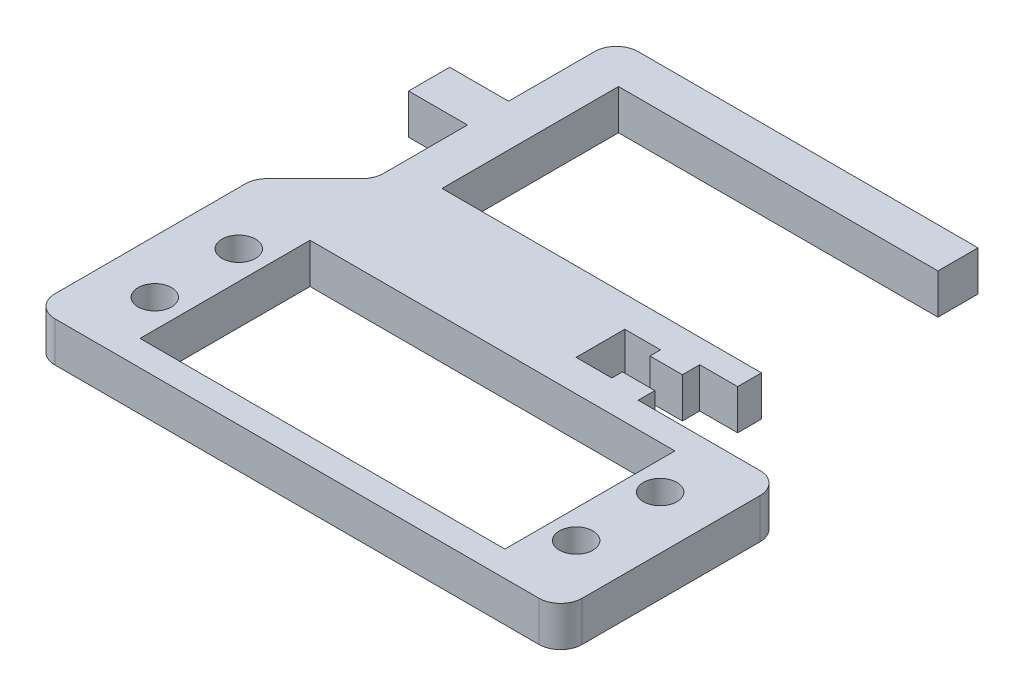
from build123d import *

# Parameters (mm, degrees)
SKETCH1_W               = 42.799
SKETCH1_H               = 19.939
BOSS_EXTRUDE1_DEPTH     = 4.699
FILLET1_R               = 2.54
CUT_EXTRUDE2_DEPTH      = 58.606234053
CUT_EXTRUDE2_DEPTH_BACK = 58.606234053
SKETCH1_3_R             = 1.9685


with BuildPart() as part:
    # Sketch1 → Boss-Extrude1 (new body)
    with BuildSketch(Plane(origin=(0, 0, 0), x_dir=(1, 0, 0), z_dir=(0, 1, 0))):
        Polygon((-23.876, 20.0152), (-30.9245, 12.9667), (-30.9245, -12.9667), (30.9245, -12.9667), (30.9245, 12.9667), (14.097, 12.9667), (14.097, 14.9225), (10.287, 14.9225), (10.287, 13.6779), (6.096, 13.6779), (6.096, 19.3929), (10.287, 19.3929), (10.287, 18.1483), (14.097, 18.1483), (14.097, 20.1803), (18.542, 20.1803), (18.542, 22.9743), (-18.923, 22.9743), (-18.923, 43.6753), (18.542, 43.6753), (18.542, 48.3743), (-23.876, 48.3743), (-23.876, 35.7378), (-30.7848, 35.7378), (-30.7848, 30.9118), (-23.876, 30.9118), align=None)
        Rectangle(SKETCH1_W, SKETCH1_H, mode=Mode.SUBTRACT)
    extrude(amount=BOSS_EXTRUDE1_DEPTH)

    # Fillet1
    fillet1_edges = [part.edges().sort_by_distance(p)[0] for p in [
        (-23.876, 2.3495, -48.3743),
        (-23.876, 2.3495, -20.0152),
        (-30.9245, 2.3495, -12.9667),
        (-30.9245, 2.3495, 12.9667),
        (30.9245, 2.3495, 12.9667),
        (30.9245, 2.3495, -12.9667),
    ]]
    fillet(fillet1_edges, radius=FILLET1_R)

    # Sketch1<3> → Cut-Extrude2 (cut, two sides: drawn at the far end of the back side and taken through both)
    with BuildSketch(Plane(origin=(0, 0, 0), x_dir=(1, 0, 0), z_dir=(0, 1, 0)).offset(-CUT_EXTRUDE2_DEPTH_BACK)):
        with Locations((24.71166, 4.92506)):
            Circle(SKETCH1_3_R)
        with Locations((24.71166, -4.92506)):
            Circle(SKETCH1_3_R)
        with Locations((-24.71166, -4.92506)):
            Circle(SKETCH1_3_R)
        with Locations((-24.71166, 4.92506)):
            Circle(SKETCH1_3_R)
    extrude(amount=CUT_EXTRUDE2_DEPTH + CUT_EXTRUDE2_DEPTH_BACK, mode=Mode.SUBTRACT)


solid = part.part
